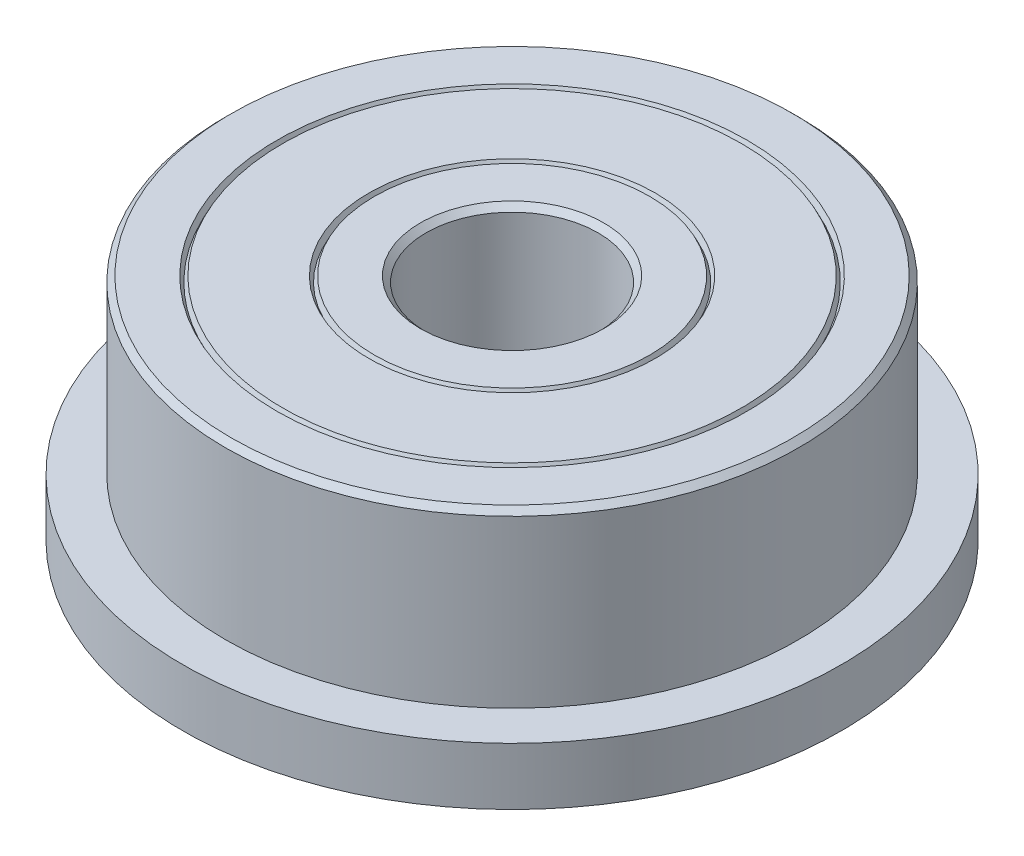
from build123d import *

# Parameters (mm, degrees)
CHAMFER1_SIZE = 0.1


with BuildPart() as part:
    # Sketch1 → Revolve1 (revolve)
    with BuildSketch(Plane(origin=(0, 0, 0), x_dir=(0, 0, -1), z_dir=(1, 0, 0))):
        Polygon((5, -1), (5, 2), (4.099649114, 2), (4.049649114, 1.9), (3.999649114, 2), (2.500350886, 2), (2.450350886, 1.9), (2.400350886, 2), (1.5, 2), (1.5, -2), (2.400350886, -2), (2.450350886, -1.9), (2.500350886, -2), (3.999649114, -2), (4.049649114, -1.9), (4.099649114, -2), (5.75, -2), (5.75, -1), align=None)
    revolve(axis=Axis((0, -2, 0), (0, 1, 0)))

    # Chamfer1
    chamfer1_edges = [part.edges().sort_by_distance(p)[0] for p in [
        (0, 2, 1.5),
        (0, 2, 5),
        (0, -2, 1.5),
    ]]
    chamfer(chamfer1_edges, length=CHAMFER1_SIZE)


solid = part.part
